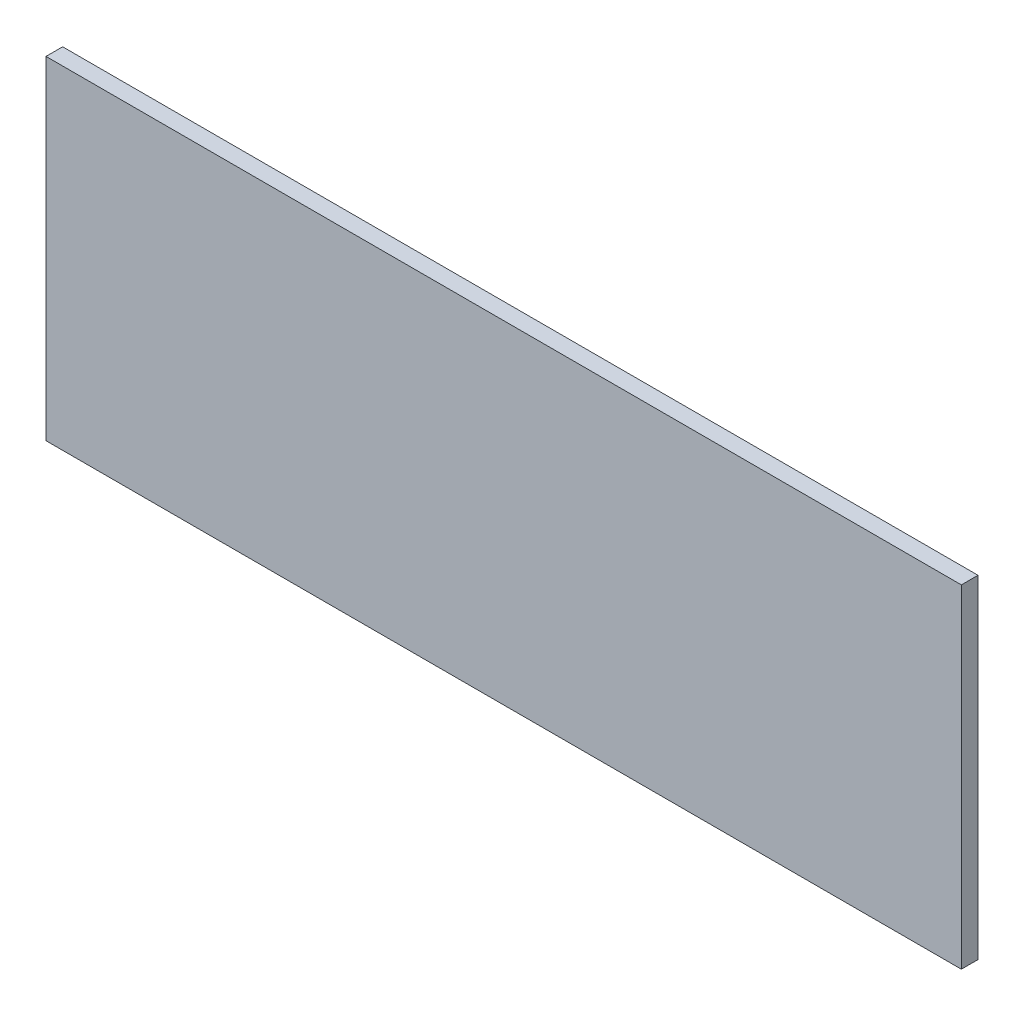
from build123d import *

# Parameters (mm, degrees)
ESQUISSE1_W        = 330
ESQUISSE1_H        = 120
BOSS_EXTRU_1_DEPTH = 6


with BuildPart() as part:
    # Esquisse1 → Boss.-Extru.1 (new body)
    with BuildSketch(Plane.XY):
        Rectangle(ESQUISSE1_W, ESQUISSE1_H)
    extrude(amount=BOSS_EXTRU_1_DEPTH)


solid = part.part
